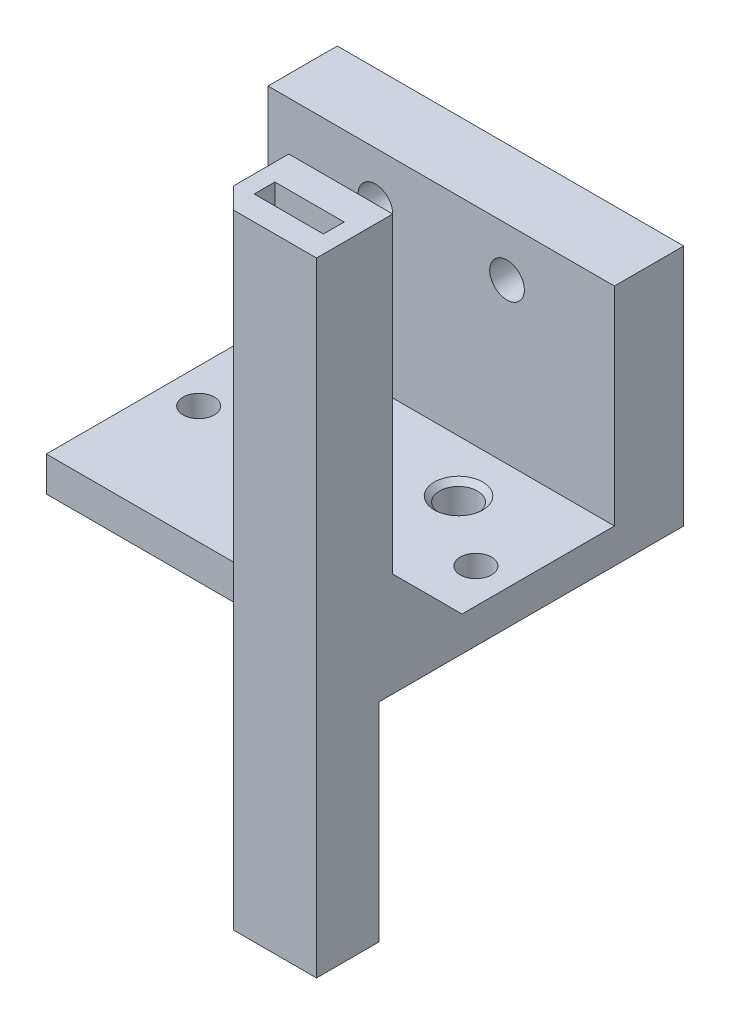
from build123d import *

# Parameters (mm, degrees)
SKETCH1_R                = 2.75
SKETCH1_R_2              = 2.25
BOSS_EXTRUDE1_DEPTH      = 5
SKETCH3_W                = 50
SKETCH3_H                = 10
BOSS_EXTRUDE3_DEPTH      = 30
SKETCH4_R                = 2.5
CUT_EXTRUDE1_DEPTH       = 61.116553461
CHAMFER1_SIZE            = 0.75
BOSS_EXTRUDE4_DEPTH      = 30
BOSS_EXTRUDE4_DEPTH_BACK = 60
SKETCH5_W                = 10
SKETCH5_H                = 3
CHAMFER2_SIZE            = 10
CHAMFER3_SIZE            = 5
SKETCH7_W                = 2
SKETCH7_H                = 30
CUT_EXTRUDE2_DEPTH       = 88.749643874


with BuildPart() as part:
    # Sketch1 → Boss-Extrude1 (new body)
    with BuildSketch(Plane(origin=(0, 0, 0), x_dir=(1, 0, 0), z_dir=(0, 1, 0))):
        Polygon((-25, 0), (-25, 40), (25, 40), (25, 0), (25, -2), (-25, -2), align=None)
        with Locations(Location((-10, 22.5, 0), (0, 0, 270))):
            Circle(SKETCH1_R, mode=Mode.SUBTRACT)
        with Locations(Location((10, 22.5, 0), (0, 0, 270))):
            Circle(SKETCH1_R, mode=Mode.SUBTRACT)
        with Locations(Location((-20, 15, 0), (0, 0, 270))):
            Circle(SKETCH1_R_2, mode=Mode.SUBTRACT)
        with Locations(Location((20, 15, 0), (0, 0, 270))):
            Circle(SKETCH1_R_2, mode=Mode.SUBTRACT)
        with Locations(Location((0, 6, 0), (0, 0, 270))):
            Circle(SKETCH1_R, mode=Mode.SUBTRACT)
    extrude(amount=BOSS_EXTRUDE1_DEPTH)

    # Sketch3 → Boss-Extrude3 (add)
    with BuildSketch(Plane(origin=(0, 5, 0), x_dir=(1, 0, 0), z_dir=(0, 1, 0))):
        with Locations((0, 35)):
            Rectangle(SKETCH3_W, SKETCH3_H)
    extrude(amount=BOSS_EXTRUDE3_DEPTH)

    # Sketch4 → Cut-Extrude1 (cut, through all)
    with BuildSketch(Plane(origin=(0, 0, -40), x_dir=(-1, 0, 0), z_dir=(0, 0, -1))):
        with Locations((-9.5, 28)):
            Circle(SKETCH4_R)
        with Locations((9.5, 28)):
            Circle(SKETCH4_R)
    extrude(amount=-CUT_EXTRUDE1_DEPTH, mode=Mode.SUBTRACT)

    # Chamfer1
    chamfer1_edges = [part.edges().sort_by_distance(p)[0] for p in [
        (-10, 5, -25.25),
        (10, 5, -25.25),
        (0, 5, -8.75),
    ]]
    chamfer(chamfer1_edges, length=CHAMFER1_SIZE)

    # Sketch5 → Boss-Extrude4 (add, two sides: drawn at the far end of the back side and taken through both)
    with BuildSketch(Plane.XZ.offset(-BOSS_EXTRUDE4_DEPTH_BACK)):
        Polygon((13, 13), (10, 10), (10, 2), (25, 2), (25, 13), align=None)
        with Locations((17.5, 8)):
            Rectangle(SKETCH5_W, SKETCH5_H, mode=Mode.SUBTRACT)
    extrude(amount=BOSS_EXTRUDE4_DEPTH + BOSS_EXTRUDE4_DEPTH_BACK)

    # Chamfer2
    chamfer2_edges = [part.edges().sort_by_distance(p)[0] for p in [
        (17.5, 5, 2),
    ]]
    chamfer(chamfer2_edges, length=CHAMFER2_SIZE)

    # Chamfer3
    chamfer3_edges = [part.edges().sort_by_distance(p)[0] for p in [
        (10, 2.5, 2),
        (10, 5, -3),
    ]]
    chamfer(chamfer3_edges, length=CHAMFER3_SIZE)

    # Sketch7 → Cut-Extrude2 (cut, through all)
    with BuildSketch(Plane(origin=(25, 0, 0), x_dir=(0, 0, -1), z_dir=(1, 0, 0))):
        with Locations((-3, -15)):
            Rectangle(SKETCH7_W, SKETCH7_H)
    extrude(amount=-CUT_EXTRUDE2_DEPTH, mode=Mode.SUBTRACT)


solid = part.part
